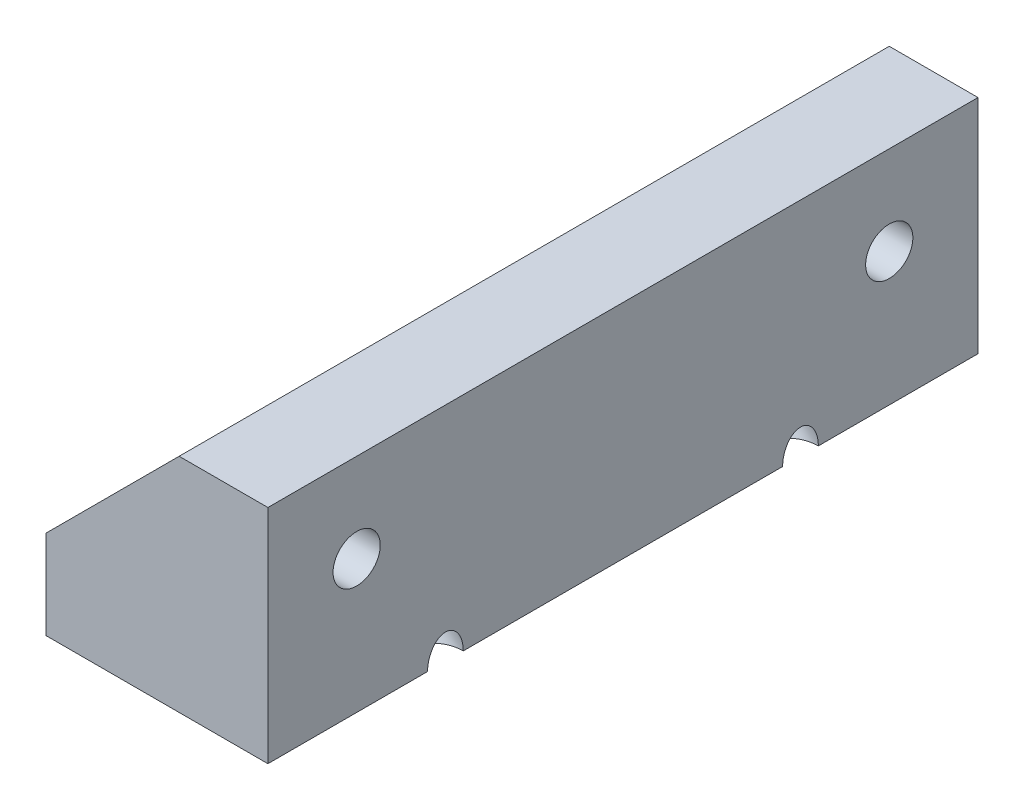
from build123d import *

# Parameters (mm, degrees)
SKETCH1_W                                        = 31.75
SKETCH1_H                                        = 101.6
BOSS_EXTRUDE1_DEPTH                              = 15.875
CUT_EXTRUDE1_REACH                               = 106.051
F_1_4_20_TAPPED_HOLE1_D                          = 5.1054
CBORE_FOR_1_4_SOCKET_HEAD_CAP_SCREW1_D           = 6.7564
CBORE_FOR_1_4_SOCKET_HEAD_CAP_SCREW1_CBORE_D     = 11.1125
CBORE_FOR_1_4_SOCKET_HEAD_CAP_SCREW1_CBORE_DEPTH = 20.32


with BuildPart() as part:
    # Sketch1 → Boss-Extrude1 (new, symmetric)
    with BuildSketch(Plane(origin=(0, 0, 0), x_dir=(1, 0, 0), z_dir=(0, 1, 0))):
        Rectangle(SKETCH1_W, SKETCH1_H)
    extrude(amount=BOSS_EXTRUDE1_DEPTH, both=True)

    # Sketch2 → Cut-Extrude1 (cut, up to next)
    with BuildSketch(Plane.XY.offset(50.8), mode=Mode.PRIVATE) as cut_extrude1_sk1:
        Polygon((-15.875, -3.175), (-15.875, 15.875), (3.175, 15.875), align=None)
    cut_extrude1_tool1 = extrude(cut_extrude1_sk1.sketch, amount=-CUT_EXTRUDE1_REACH, mode=Mode.PRIVATE) & part.part
    add(cut_extrude1_tool1.solids().sort_by_distance((-9.525, 9.525, 50.8))[0], mode=Mode.SUBTRACT)

    # 1/4-20 Tapped Hole1 (through all)
    with Locations(Plane(origin=(-6.35, 6.35, 0), x_dir=(0, 0, 1), z_dir=(-0.7071067811865513, 0.7071067811865438, 0))):
        with Locations((-25.4, 0), (25.4, 0)):
            Hole(F_1_4_20_TAPPED_HOLE1_D / 2)

    # CBORE for 1/4 Socket Head Cap Screw1 (through all)
    with Locations(Plane.ZY.offset(15.875)):
        with Locations((-38.1, 3.175), (38.1, 3.175)):
            CounterBoreHole(CBORE_FOR_1_4_SOCKET_HEAD_CAP_SCREW1_D / 2, CBORE_FOR_1_4_SOCKET_HEAD_CAP_SCREW1_CBORE_D / 2, CBORE_FOR_1_4_SOCKET_HEAD_CAP_SCREW1_CBORE_DEPTH)


solid = part.part
